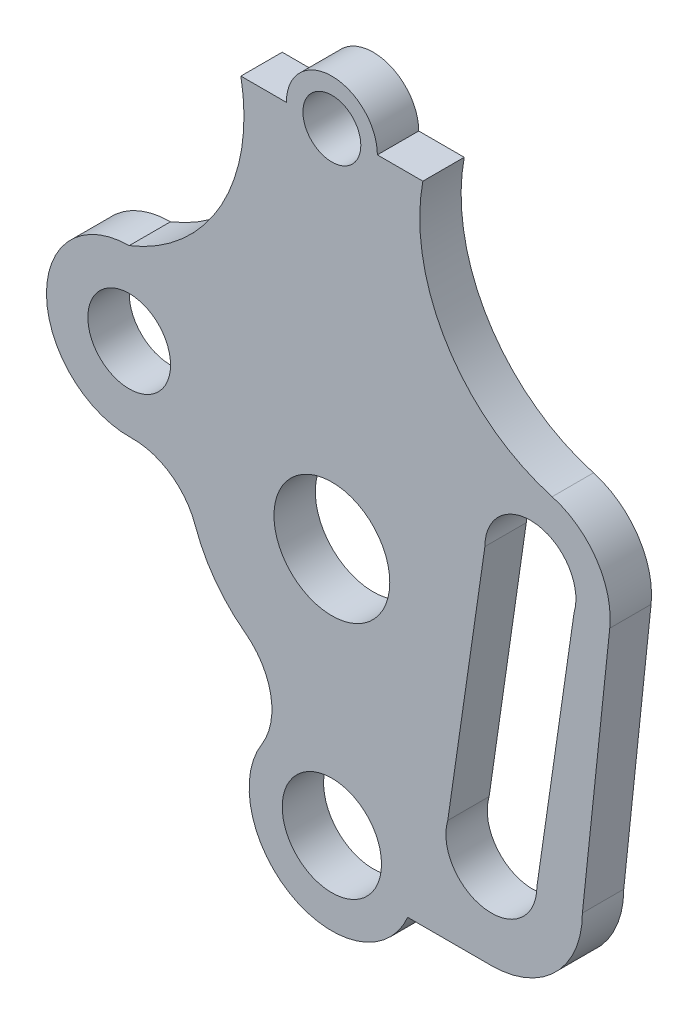
from build123d import *

# Parameters (mm, degrees)
SKETCH1_R           = 12
SKETCH1_R_2         = 14
SKETCH1_R_3         = 10
SKETCH1_R_4         = 7
BOSS_EXTRUDE1_DEPTH = 5


with BuildPart() as part:
    # Sketch1 → Boss-Extrude1 (new, symmetric)
    with BuildSketch(Plane.XY):
        with BuildLine():
            ThreePointArc((11, 88), (0, 99), (-11, 88))
            Line((-11, 88), (-22, 88))
            ThreePointArc((-22, 88), (-26.70940007, 58.656200039), (-49, 39))
            ThreePointArc((-49, 39), (-68.998392946, 18.746465817), (-48.492972379, -0.993572042))
            ThreePointArc((-48.492972379, -0.993572042), (-39.014510451, -3.809523143), (-33.001122743, -11.658726248))
            ThreePointArc((-33.001122743, -11.658726248), (-28.18429152, -20.752004999), (-20.931196761, -28.051470588))
            ThreePointArc((-20.931196761, -28.051470588), (-14.77228566, -37.934411824), (-16.94430214, -49.375))
            ThreePointArc((-16.94430214, -49.375), (-9.320242105, -77.695566877), (18.346551197, -67.962666587))
            Line((18.346551197, -67.962666587), (38.567256581, -67.962666587))
            ThreePointArc((38.567256581, -67.962666587), (54.123605767, -61.519015773), (60.567256581, -45.962666587))
            Line((60.567256581, -45.962666587), (67.180494628, 16.984907625))
            ThreePointArc((67.180494628, 16.984907625), (63.971087494, 29.810935932), (53.255704219, 37.556118792))
            ThreePointArc((53.255704219, 37.556118792), (27.844090476, 56.715909688), (22, 88))
            Line((22, 88), (11, 88))
        make_face()
        with Locations((0, -60)):
            Circle(SKETCH1_R, mode=Mode.SUBTRACT)
        Circle(SKETCH1_R_2, mode=Mode.SUBTRACT)
        with BuildLine():
            Line((34.793024979, 3.800712147), (37, 19))
            ThreePointArc((37, 19), (48, 30), (59, 19))
            ThreePointArc((59, 19), (58.885841276, 17.419348327), (58.545734598, 15.871504867))
            Line((58.545734598, 15.871504867), (49.567256581, -45.962666587))
            ThreePointArc((49.567256581, -45.962666587), (38.567256581, -56.962666587), (27.567256581, -45.962666587))
            ThreePointArc((27.567256581, -45.962666587), (27.681415305, -44.382014914), (28.021521984, -42.834171454))
            Line((28.021521984, -42.834171454), (34.793024979, 3.800712147))
        make_face(mode=Mode.SUBTRACT)
        with Locations((-49, 19)):
            Circle(SKETCH1_R_3, mode=Mode.SUBTRACT)
        with Locations((0, 88)):
            Circle(SKETCH1_R_4, mode=Mode.SUBTRACT)
    extrude(amount=BOSS_EXTRUDE1_DEPTH, both=True)


solid = part.part
